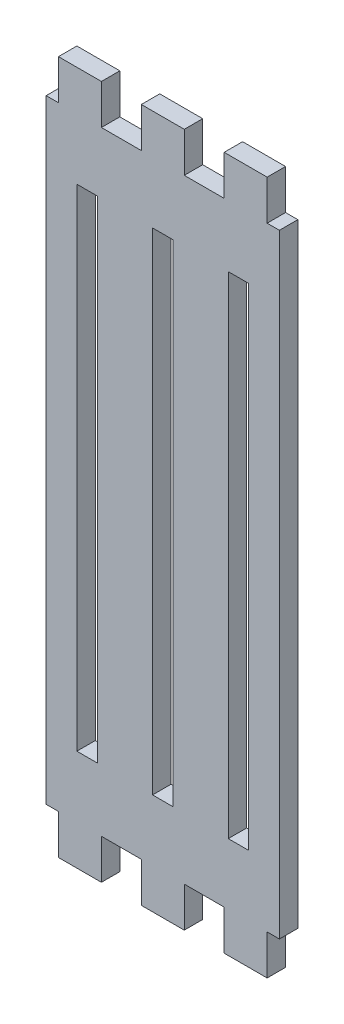
from build123d import *

# Parameters (mm, degrees)
SKETCH_1_W      = 3.333333333
SKETCH_1_H      = 80
SKETCH_1_W_2    = 3.333333334
EXTRUDE_1_DEPTH = 3


with BuildPart() as part:
    # 草图1 → 凸台-拉伸1 (new body)
    with BuildSketch(Plane.XY):
        Polygon((-17, 56.5), (-17, 50), (-19, 50), (-19, -50), (-17, -50), (-17, -56.5), (-10, -56.5), (-10, -50), (-3.5, -50), (-3.5, -56.5), (3.5, -56.5), (3.5, -50), (10, -50), (10, -56.5), (17, -56.5), (17, -50), (19, -50), (19, 50), (17, 50), (17, 56.5), (10, 56.5), (10, 50), (3.5, 50), (3.5, 56.5), (-3.5, 56.5), (-3.5, 50), (-10, 50), (-10, 56.5), align=None)
        with Locations((12.333333334, 0)):
            Rectangle(SKETCH_1_W, SKETCH_1_H, mode=Mode.SUBTRACT)
        with Locations((-12.333333334, 0)):
            Rectangle(SKETCH_1_W, SKETCH_1_H, mode=Mode.SUBTRACT)
        Rectangle(SKETCH_1_W_2, SKETCH_1_H, mode=Mode.SUBTRACT)
    extrude(amount=EXTRUDE_1_DEPTH)


solid = part.part
